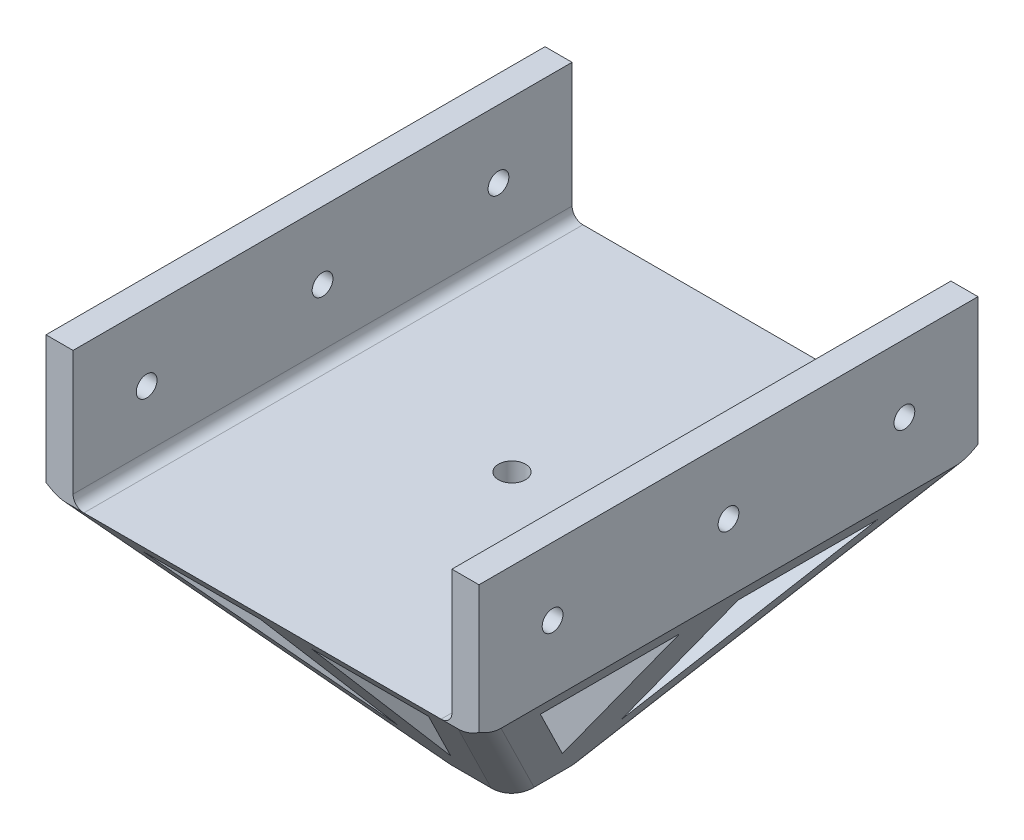
from build123d import *

# Parameters (mm, degrees)
BOSS_EXTRUDE1_DEPTH = 117.094
SKETCH3_R           = 2.4384
CUT_EXTRUDE1_DEPTH  = 166.226170252
SKETCH4_R           = 3.175
CUT_EXTRUDE2_DEPTH  = 166.226170252
CUT_EXTRUDE3_DEPTH  = 166.226170252
FILLET1_R           = 6.35
CUT_EXTRUDE4_DEPTH  = 166.226170252
CUT_EXTRUDE5_DEPTH  = 110.744


with BuildPart() as part:
    # Sketch2 → Boss-Extrude1 (new body)
    with BuildSketch(Plane.XY):
        with BuildLine():
            Line((95.25, 31.75), (101.6, 31.75))
            Line((101.6, 31.75), (101.6, 0))
            Line((101.6, 0), (60.325, -57.15))
            Line((60.325, -57.15), (41.275, -57.15))
            Line((41.275, -57.15), (0, 0))
            Line((0, 0), (0, 31.75))
            Line((0, 31.75), (6.35, 31.75))
            Line((6.35, 31.75), (6.35, 2.54))
            ThreePointArc((6.35, 2.54), (7.093948776, 0.743948776), (8.89, 0))
            Line((8.89, 0), (92.71, 0))
            ThreePointArc((92.71, 0), (94.506051224, 0.743948776), (95.25, 2.54))
            Line((95.25, 2.54), (95.25, 31.75))
        make_face()
    extrude(amount=BOSS_EXTRUDE1_DEPTH)

    # Sketch3 → Cut-Extrude1 (cut, through all)
    with BuildSketch(Plane(origin=(101.6, 0, 0), x_dir=(0, 0, -1), z_dir=(1, 0, 0))):
        with Locations((-99.822, 15.875)):
            Circle(SKETCH3_R)
        with Locations((-58.547, 15.875)):
            Circle(SKETCH3_R)
        with Locations((-17.272, 15.875)):
            Circle(SKETCH3_R)
    extrude(amount=-CUT_EXTRUDE1_DEPTH, mode=Mode.SUBTRACT)

    # Sketch4 → Cut-Extrude2 (cut, through all)
    with BuildSketch(Plane(origin=(0, 0, 0), x_dir=(1, 0, 0), z_dir=(0, 1, 0))):
        with Locations(Location((50.8, -58.547, 0), (0, 0, 270))):
            Circle(SKETCH4_R)
    extrude(amount=-CUT_EXTRUDE2_DEPTH, mode=Mode.SUBTRACT)

    # Sketch5 → Cut-Extrude3 (cut, through all)
    with BuildSketch(Plane(origin=(101.6, 0, 0), x_dir=(0, 0, -1), z_dir=(1, 0, 0))):
        Polygon((-117.094, 0), (-117.094, -57.15), (-68.072, -57.15), align=None)
        Polygon((-49.022, -57.15), (0, -57.15), (0, 0), align=None)
    extrude(amount=-CUT_EXTRUDE3_DEPTH, mode=Mode.SUBTRACT)

    # Fillet1
    fillet1_edges = [part.edges().sort_by_distance(p)[0] for p in [
        (80.9625, -28.575, 92.583),
        (20.6375, -28.575, 92.583),
        (80.9625, -28.575, 24.511),
        (20.6375, -28.575, 24.511),
    ]]
    fillet(fillet1_edges, radius=FILLET1_R)

    # Sketch7 → Cut-Extrude4 (cut, through all)
    with BuildSketch(Plane(origin=(101.6, 0, 0), x_dir=(0, 0, -1), z_dir=(1, 0, 0))):
        Polygon((-98.104076531, -6.35), (-65.422743198, -44.45), (-65.422743198, -6.35), align=None)
        Polygon((-18.989923469, -6.35), (-51.671256802, -6.35), (-51.671256802, -44.45), align=None)
    extrude(amount=-CUT_EXTRUDE4_DEPTH, mode=Mode.SUBTRACT)

    # Sketch8 → Cut-Extrude5 (cut)
    with BuildSketch(Plane.XY.offset(117.094)):
        Polygon((17.266111361, -6.35), (44.782778028, -44.45), (44.782778028, -6.35), align=None)
        Polygon((84.333888639, -6.35), (56.817221972, -6.35), (56.817221972, -44.45), align=None)
    extrude(amount=-CUT_EXTRUDE5_DEPTH, mode=Mode.SUBTRACT)


solid = part.part
